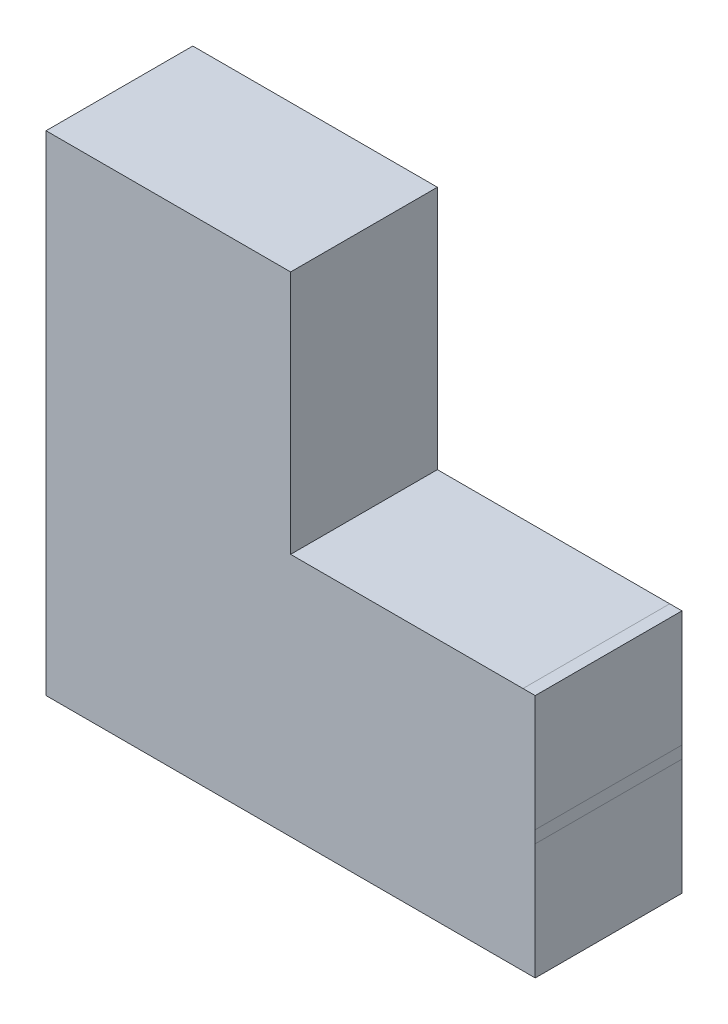
from build123d import *

# Parameters (mm, degrees)
BOSS_EXTRUDE1_DEPTH = 300


with BuildPart() as part:
    # Sketch1 → Boss-Extrude1 (new body)
    with BuildSketch(Plane.XY):
        Polygon((0, 0), (1000, 0), (1000, 500), (500, 500), (500, 1000), (0, 1000), align=None)
    extrude(amount=BOSS_EXTRUDE1_DEPTH)


solid = part.part
